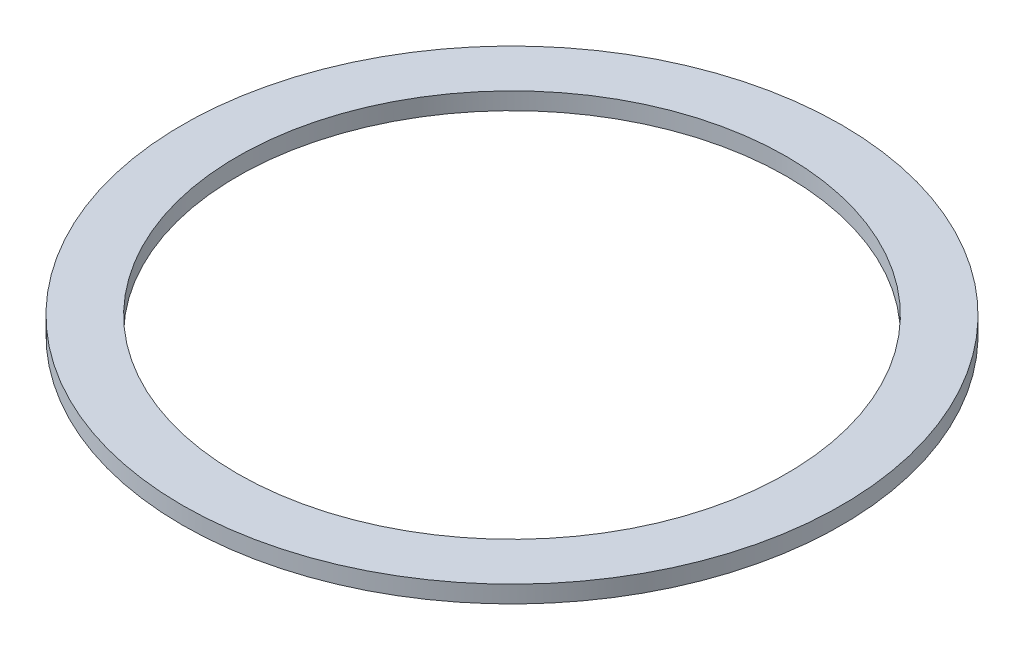
from build123d import *

# Parameters (mm, degrees)
SKETCH1_R           = 96
SKETCH1_R_2         = 80
BOSS_EXTRUDE1_DEPTH = 5


with BuildPart() as part:
    # Sketch1 → Boss-Extrude1 (new body)
    with BuildSketch(Plane(origin=(0, 0, 0), x_dir=(1, 0, 0), z_dir=(0, 1, 0))):
        with Locations(Location((0, 0, 0), (0, 0, 270))):
            Circle(SKETCH1_R)
        with Locations(Location((0, 0, 0), (0, 0, 270))):
            Circle(SKETCH1_R_2, mode=Mode.SUBTRACT)
    extrude(amount=BOSS_EXTRUDE1_DEPTH)


solid = part.part
